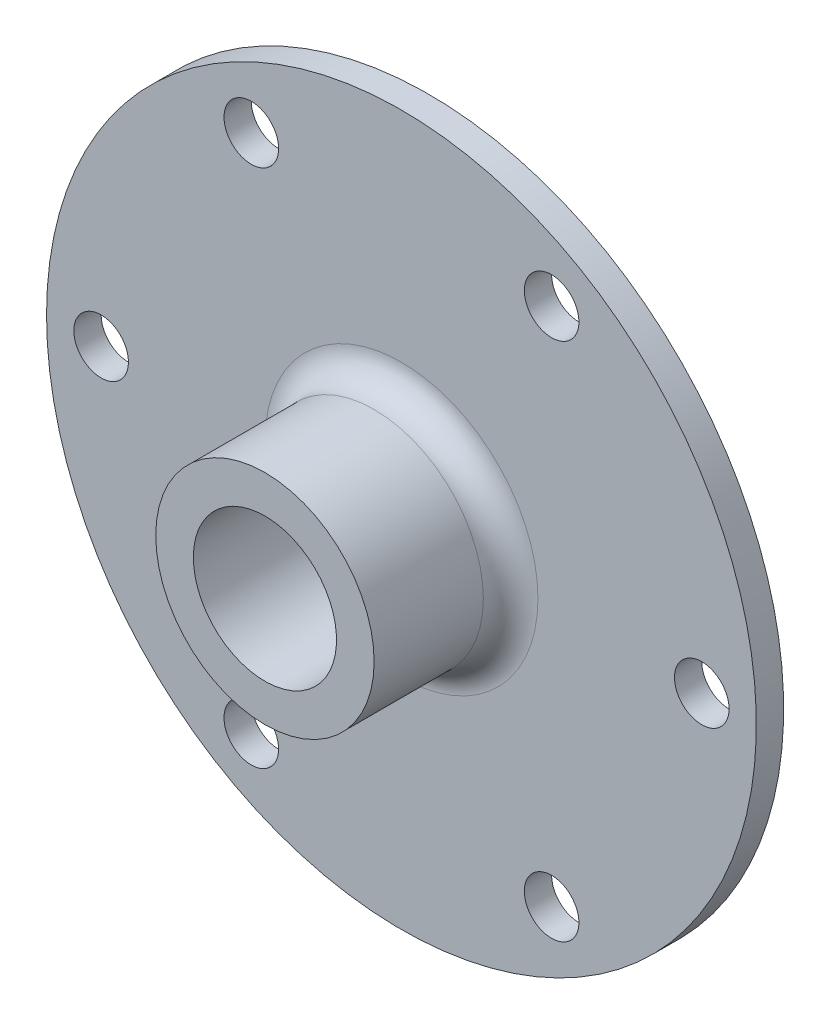
from build123d import *

# Parameters (mm, degrees)
SKETCH2_R          = 8.324772978
CUT_EXTRUDE5_DEPTH = 62.401577748
SKETCH3_R          = 3.175
CUT_EXTRUDE6_DEPTH = 61.491874454
CIRPATTERN2_COUNT  = 6
FILLET1_R          = 3.175


with BuildPart() as part:
    # Sketch1 → Revolve1 (revolve)
    with BuildSketch(Plane(origin=(0, 0, 0), x_dir=(0, 0, -1), z_dir=(1, 0, 0)), mode=Mode.PRIVATE) as revolve1_sk:
        Polygon((0, 0), (0, 41.275), (-3.175, 41.275), (-3.175, 12.7), (-19.05, 12.7), (-19.05, 0), align=None)
    revolve(revolve1_sk.sketch.rotate(Axis((0, 0, 0), (0, 0, 1)), 90), axis=Axis((0, 0, 0), (0, 0, 1)))

    # Sketch2 → Cut-Extrude5 (cut, through all)
    with BuildSketch(Plane.XY):
        with Locations(Location((0, 0, 0), (0, 0, 180))):
            Circle(SKETCH2_R)
    extrude(amount=CUT_EXTRUDE5_DEPTH, mode=Mode.SUBTRACT)

    # Sketch3 → Cut-Extrude6 (cut, through all)
    with BuildSketch(Plane.XY.offset(3.175)):
        with Locations((34.925, 0)):
            Circle(SKETCH3_R)
    cut_extrude6 = extrude(amount=-CUT_EXTRUDE6_DEPTH, mode=Mode.SUBTRACT)

    # CirPattern2: Cut-Extrude6 ×6 about axis
    cirpattern2_axis = Axis((0, 0, 0), (0, 0, 1))
    for i in range(1, CIRPATTERN2_COUNT):
        add(cut_extrude6.rotate(cirpattern2_axis, i * 360 / CIRPATTERN2_COUNT), mode=Mode.SUBTRACT)

    # Fillet1
    fillet1_edges = [part.edges().sort_by_distance(p)[0] for p in [
        (12.7, 0, 3.175),
    ]]
    fillet(fillet1_edges, radius=FILLET1_R)


solid = part.part
